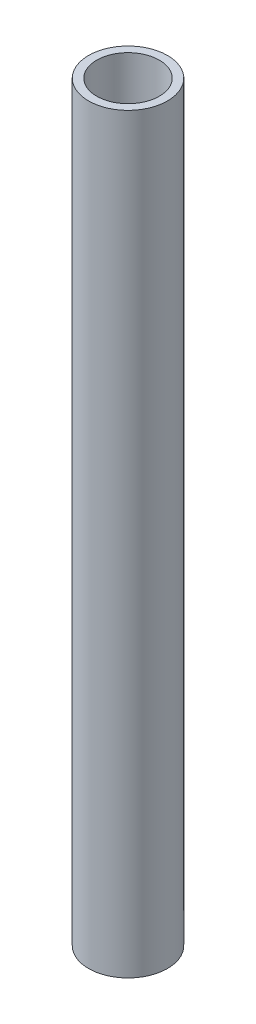
from build123d import *

# Parameters (mm, degrees)
SKETCH1_R           = 8.001
SKETCH1_R_2         = 6.35
BOSS_EXTRUDE1_DEPTH = 152.4


with BuildPart() as part:
    # Sketch1 → Boss-Extrude1 (new body)
    with BuildSketch(Plane(origin=(0, 0, 0), x_dir=(1, 0, 0), z_dir=(0, 1, 0))):
        with Locations(Location((0, 0, 0), (0, 0, 90))):
            Circle(SKETCH1_R)
        with Locations(Location((0, 0, 0), (0, 0, 90))):
            Circle(SKETCH1_R_2, mode=Mode.SUBTRACT)
    extrude(amount=BOSS_EXTRUDE1_DEPTH)


solid = part.part
